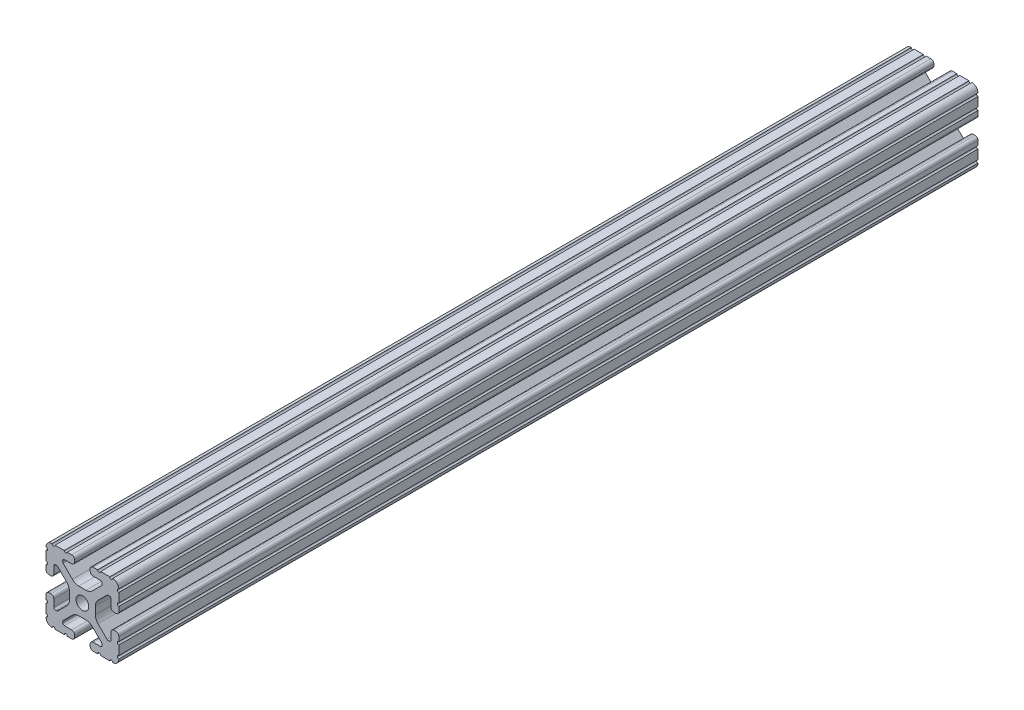
from build123d import *

# Parameters (mm, degrees)
SKETCH1_R      = 3.3274
EXTRUDE1_DEPTH = 449.58


with BuildPart() as part:
    # Sketch1 → Extrude1 (new body)
    with BuildSketch(Plane.XY):
        with BuildLine():
            Line((-10.022898969, 12.91475973), (-5.252158105, 8.144007132))
            ThreePointArc((-5.252158105, 8.144007132), (-3.715177372, 7.117027388), (-1.902183975, 6.7564))
            Line((-1.902183975, 6.7564), (1.902183975, 6.7564))
            ThreePointArc((1.902183975, 6.7564), (3.715177372, 7.117027388), (5.252158105, 8.144007132))
            Line((5.252158105, 8.144007132), (10.022898969, 12.91475973))
            ThreePointArc((10.022898969, 12.91475973), (10.218362387, 13.207291992), (10.287, 13.552357131))
            Line((10.287, 13.552357131), (10.287, 14.0843))
            ThreePointArc((10.287, 14.0843), (10.022898185, 14.721898185), (9.3853, 14.986))
            Line((9.3853, 14.986), (5.617617549, 14.986))
            ThreePointArc((5.617617549, 14.986), (4.519044045, 15.441044045), (4.064, 16.539617549))
            Line((4.064, 16.539617549), (4.064, 17.496382451))
            ThreePointArc((4.064, 17.496382451), (4.519044045, 18.594955955), (5.617617549, 19.05))
            Line((5.617617549, 19.05), (7.974178704, 19.05))
            ThreePointArc((7.974178704, 19.05), (8.736178704, 18.288), (9.498178704, 19.05))
            Line((9.498178704, 19.05), (14.327719207, 19.05))
            ThreePointArc((14.327719207, 19.05), (15.087603123, 18.231251131), (15.847487039, 19.05))
            ThreePointArc((15.847487039, 19.05), (18.120176289, 18.120192083), (19.05, 15.847509295))
            ThreePointArc((19.05, 15.847509295), (18.231250992, 15.08762539), (19.05, 14.327741484))
            Line((19.05, 14.327741484), (19.05, 9.496091471))
            ThreePointArc((19.05, 9.496091471), (18.231250992, 8.736207565), (19.05, 7.97632366))
            Line((19.05, 7.97632366), (19.05, 5.617617549))
            ThreePointArc((19.05, 5.617617549), (18.594955955, 4.519044045), (17.496382451, 4.064))
            Line((17.496382451, 4.064), (16.539617549, 4.064))
            ThreePointArc((16.539617549, 4.064), (15.441044045, 4.519044045), (14.986, 5.617617549))
            Line((14.986, 5.617617549), (14.986, 9.385342516))
            ThreePointArc((14.986, 9.385342516), (14.721898185, 10.022940701), (14.0843, 10.287042516))
            Line((14.0843, 10.287042516), (13.516042086, 10.287042516))
            ThreePointArc((13.516042086, 10.287042516), (13.170975923, 10.218404478), (12.878443117, 10.022939917))
            Line((12.878443117, 10.022939917), (8.14758008, 5.292065243))
            ThreePointArc((8.14758008, 5.292065243), (7.117955879, 3.751120653), (6.7564, 1.933453584))
            Line((6.7564, 1.933453584), (6.7564, -1.933453584))
            ThreePointArc((6.7564, -1.933453584), (7.117955879, -3.751120653), (8.14758008, -5.292065243))
            Line((8.14758008, -5.292065243), (12.878443117, -10.022939917))
            ThreePointArc((12.878443117, -10.022939917), (13.170975923, -10.218404478), (13.516042086, -10.287042516))
            Line((13.516042086, -10.287042516), (14.0843, -10.287042516))
            ThreePointArc((14.0843, -10.287042516), (14.721898185, -10.022940701), (14.986, -9.385342516))
            Line((14.986, -9.385342516), (14.986, -5.617617549))
            ThreePointArc((14.986, -5.617617549), (15.441044045, -4.519044045), (16.539617549, -4.064))
            Line((16.539617549, -4.064), (17.496382451, -4.064))
            ThreePointArc((17.496382451, -4.064), (18.594955955, -4.519044045), (19.05, -5.617617549))
            Line((19.05, -5.617617549), (19.05, -7.976318491))
            ThreePointArc((19.05, -7.976318491), (18.231250992, -8.736202396), (19.05, -9.496086302))
            Line((19.05, -9.496086302), (19.05, -14.32774291))
            ThreePointArc((19.05, -14.32774291), (18.231250992, -15.087626816), (19.05, -15.847510721))
            ThreePointArc((19.05, -15.847510721), (18.120175716, -18.120192644), (15.847486868, -19.05))
            ThreePointArc((15.847486868, -19.05), (15.087602952, -18.231251131), (14.327719036, -19.05))
            Line((14.327719036, -19.05), (9.496062448, -19.05))
            ThreePointArc((9.496062448, -19.05), (8.736178532, -18.231251131), (7.976294616, -19.05))
            Line((7.976294616, -19.05), (5.617617549, -19.05))
            ThreePointArc((5.617617549, -19.05), (4.519044045, -18.594955955), (4.064, -17.496382451))
            Line((4.064, -17.496382451), (4.064, -16.539617549))
            ThreePointArc((4.064, -16.539617549), (4.519044045, -15.441044045), (5.617617549, -14.986))
            Line((5.617617549, -14.986), (9.3853, -14.986))
            ThreePointArc((9.3853, -14.986), (10.022898185, -14.721898185), (10.287, -14.0843))
            Line((10.287, -14.0843), (10.287, -13.552357131))
            ThreePointArc((10.287, -13.552357131), (10.218362387, -13.207291992), (10.022898969, -12.91475973))
            Line((10.022898969, -12.91475973), (5.252158105, -8.144007132))
            ThreePointArc((5.252158105, -8.144007132), (3.715177372, -7.117027388), (1.902183975, -6.7564))
            Line((1.902183975, -6.7564), (-1.902183975, -6.7564))
            ThreePointArc((-1.902183975, -6.7564), (-3.715177372, -7.117027388), (-5.252158105, -8.144007132))
            Line((-5.252158105, -8.144007132), (-10.022898969, -12.91475973))
            ThreePointArc((-10.022898969, -12.91475973), (-10.218362387, -13.207291992), (-10.287, -13.552357131))
            Line((-10.287, -13.552357131), (-10.287, -14.0843))
            ThreePointArc((-10.287, -14.0843), (-10.022898185, -14.721898185), (-9.3853, -14.986))
            Line((-9.3853, -14.986), (-5.617617549, -14.986))
            ThreePointArc((-5.617617549, -14.986), (-4.519044045, -15.441044045), (-4.064, -16.539617549))
            Line((-4.064, -16.539617549), (-4.064, -17.496382451))
            ThreePointArc((-4.064, -17.496382451), (-4.519044045, -18.594955955), (-5.617617549, -19.05))
            Line((-5.617617549, -19.05), (-7.976294616, -19.05))
            ThreePointArc((-7.976294616, -19.05), (-8.736178532, -18.231251131), (-9.496062448, -19.05))
            Line((-9.496062448, -19.05), (-14.327719036, -19.05))
            ThreePointArc((-14.327719036, -19.05), (-15.087602952, -18.231251131), (-15.847486868, -19.05))
            ThreePointArc((-15.847486868, -19.05), (-18.120175716, -18.120192644), (-19.05, -15.847510721))
            ThreePointArc((-19.05, -15.847510721), (-18.231250992, -15.087626816), (-19.05, -14.32774291))
            Line((-19.05, -14.32774291), (-19.05, -9.496086302))
            ThreePointArc((-19.05, -9.496086302), (-18.231250992, -8.736202396), (-19.05, -7.976318491))
            Line((-19.05, -7.976318491), (-19.05, -5.617617549))
            ThreePointArc((-19.05, -5.617617549), (-18.594955955, -4.519044045), (-17.496382451, -4.064))
            Line((-17.496382451, -4.064), (-16.539617549, -4.064))
            ThreePointArc((-16.539617549, -4.064), (-15.441044045, -4.519044045), (-14.986, -5.617617549))
            Line((-14.986, -5.617617549), (-14.986, -9.385342516))
            ThreePointArc((-14.986, -9.385342516), (-14.721898185, -10.022940701), (-14.0843, -10.287042516))
            Line((-14.0843, -10.287042516), (-13.516042086, -10.287042516))
            ThreePointArc((-13.516042086, -10.287042516), (-13.170975923, -10.218404478), (-12.878443117, -10.022939917))
            Line((-12.878443117, -10.022939917), (-8.14758008, -5.292065243))
            ThreePointArc((-8.14758008, -5.292065243), (-7.117955879, -3.751120653), (-6.7564, -1.933453584))
            Line((-6.7564, -1.933453584), (-6.7564, 1.933453584))
            ThreePointArc((-6.7564, 1.933453584), (-7.117955879, 3.751120653), (-8.14758008, 5.292065243))
            Line((-8.14758008, 5.292065243), (-12.878443117, 10.022939917))
            ThreePointArc((-12.878443117, 10.022939917), (-13.170975923, 10.218404478), (-13.516042086, 10.287042516))
            Line((-13.516042086, 10.287042516), (-14.0843, 10.287042516))
            ThreePointArc((-14.0843, 10.287042516), (-14.721898185, 10.022940701), (-14.986, 9.385342516))
            Line((-14.986, 9.385342516), (-14.986, 5.617617549))
            ThreePointArc((-14.986, 5.617617549), (-15.441044045, 4.519044045), (-16.539617549, 4.064))
            Line((-16.539617549, 4.064), (-17.496382451, 4.064))
            ThreePointArc((-17.496382451, 4.064), (-18.594955955, 4.519044045), (-19.05, 5.617617549))
            Line((-19.05, 5.617617549), (-19.05, 7.97632366))
            ThreePointArc((-19.05, 7.97632366), (-18.231250992, 8.736207565), (-19.05, 9.496091471))
            Line((-19.05, 9.496091471), (-19.05, 14.327741484))
            ThreePointArc((-19.05, 14.327741484), (-18.231250992, 15.08762539), (-19.05, 15.847509295))
            ThreePointArc((-19.05, 15.847509295), (-18.120176289, 18.120192083), (-15.847487039, 19.05))
            ThreePointArc((-15.847487039, 19.05), (-15.087603123, 18.231251131), (-14.327719207, 19.05))
            Line((-14.327719207, 19.05), (-9.498178704, 19.05))
            ThreePointArc((-9.498178704, 19.05), (-8.736178704, 18.288), (-7.974178704, 19.05))
            Line((-7.974178704, 19.05), (-5.617617549, 19.05))
            ThreePointArc((-5.617617549, 19.05), (-4.519044045, 18.594955955), (-4.064, 17.496382451))
            Line((-4.064, 17.496382451), (-4.064, 16.539617549))
            ThreePointArc((-4.064, 16.539617549), (-4.519044045, 15.441044045), (-5.617617549, 14.986))
            Line((-5.617617549, 14.986), (-9.3853, 14.986))
            ThreePointArc((-9.3853, 14.986), (-10.022898185, 14.721898185), (-10.287, 14.0843))
            Line((-10.287, 14.0843), (-10.287, 13.552357131))
            ThreePointArc((-10.287, 13.552357131), (-10.218362387, 13.207291992), (-10.022898969, 12.91475973))
        make_face()
        Circle(SKETCH1_R, mode=Mode.SUBTRACT)
    extrude(amount=-EXTRUDE1_DEPTH)


solid = part.part
